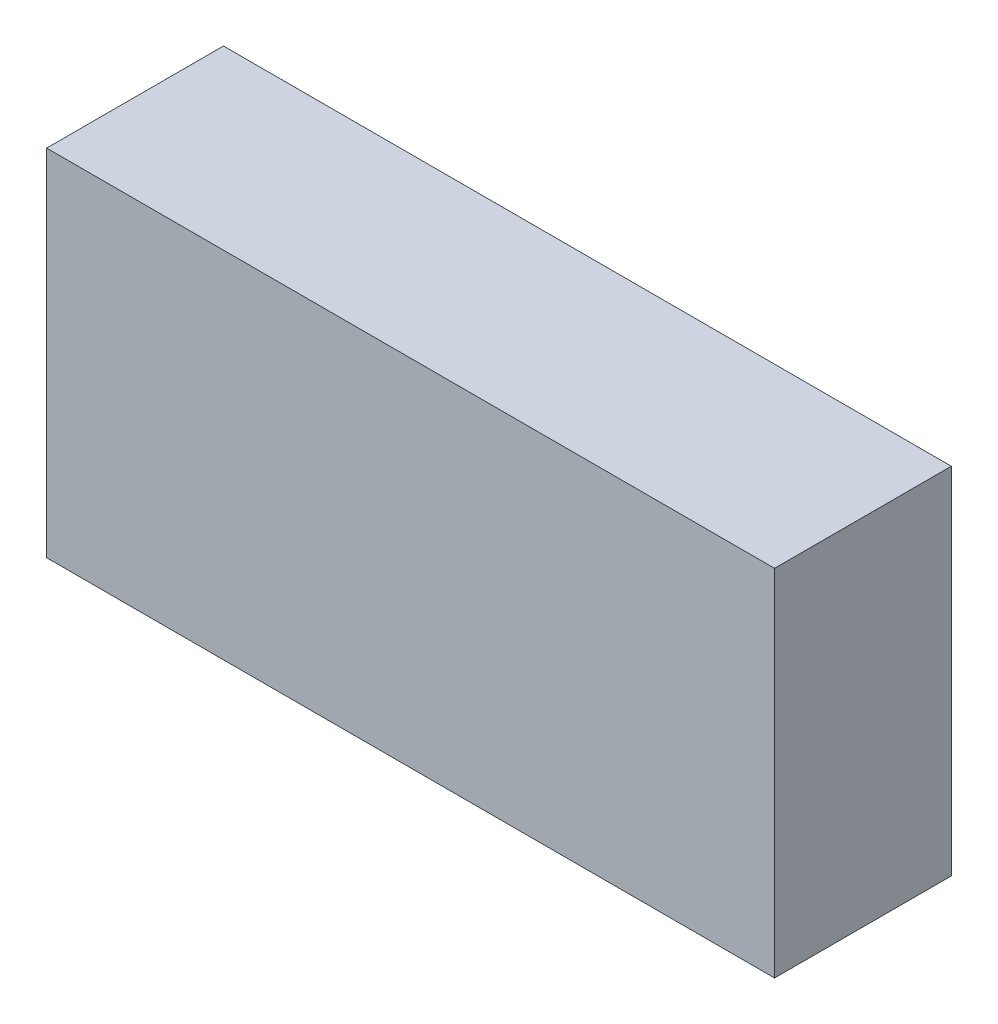
from build123d import *

# Parameters (mm, degrees)
SKETCH1_W           = 76.962
SKETCH1_H           = 18.6944
BOSS_EXTRUDE2_DEPTH = 37.5158


with BuildPart() as part:
    # Sketch1 → Boss-Extrude2 (new body)
    with BuildSketch(Plane(origin=(0, 0, 0), x_dir=(1, 0, 0), z_dir=(0, 1, 0))):
        with Locations((-38.481, 9.3472)):
            Rectangle(SKETCH1_W, SKETCH1_H)
    extrude(amount=BOSS_EXTRUDE2_DEPTH)


solid = part.part
